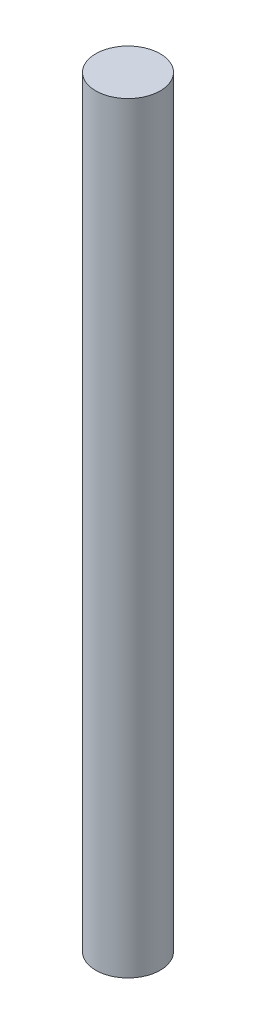
from build123d import *

# Parameters (mm, degrees)
SKETCH1_R           = 22.5
BOSS_EXTRUDE1_DEPTH = 532


with BuildPart() as part:
    # Sketch1 → Boss-Extrude1 (new body)
    with BuildSketch(Plane(origin=(0, 0, 0), x_dir=(1, 0, 0), z_dir=(0, 1, 0))):
        with Locations(Location((0, 0, 0), (0, 0, 270))):
            Circle(SKETCH1_R)
    extrude(amount=BOSS_EXTRUDE1_DEPTH)


solid = part.part
